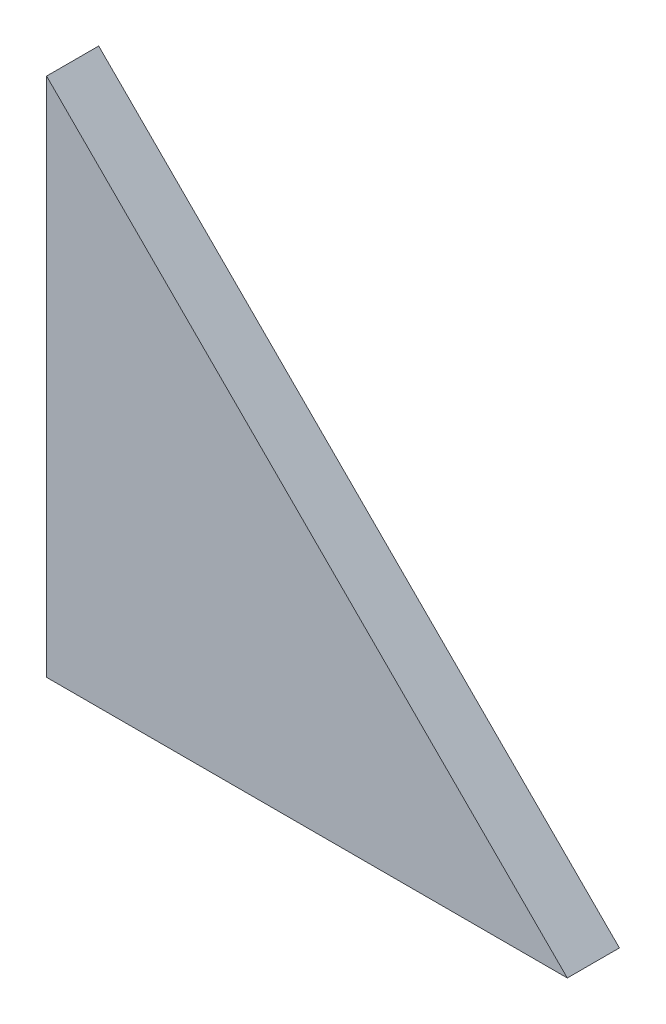
from build123d import *

# Parameters (mm, degrees)
AUFSATZ_LINEAR_AUSTRAGEN1_DEPTH = 4


with BuildPart() as part:
    # Skizze1 → Aufsatz-Linear austragen1 (new body)
    with BuildSketch(Plane.XY):
        Polygon((0, 0), (0, 40), (40, 0), align=None)
    extrude(amount=AUFSATZ_LINEAR_AUSTRAGEN1_DEPTH)


solid = part.part
